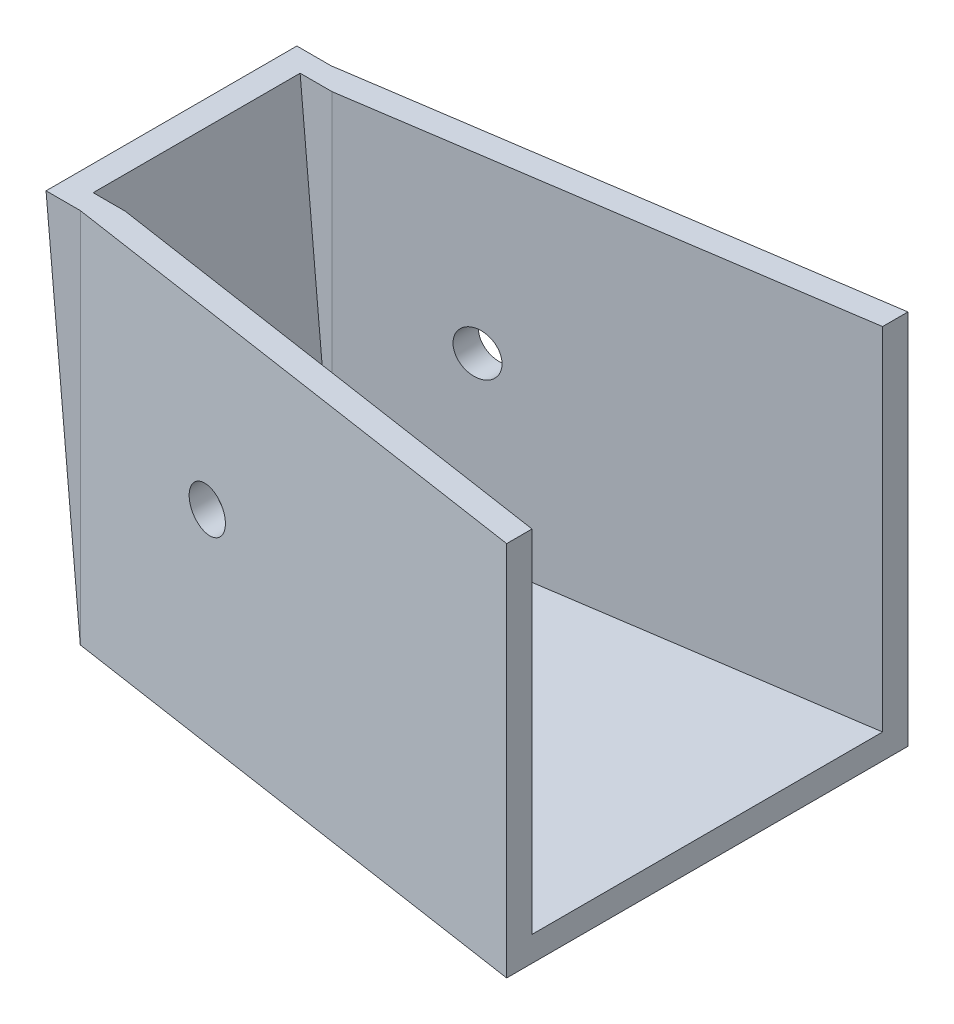
from build123d import *

# Parameters (mm, degrees)
BOSS_EXTRUDE1_DEPTH = 3
BOSS_EXTRUDE2_DEPTH = 15
BOSS_EXTRUDE3_DEPTH = 42
SKETCH6_W           = 2.622655796
SKETCH6_H           = 42
SKETCH6_H_2         = 45
BOSS_EXTRUDE4_DEPTH = 4
CUT_EXTRUDE1_DEPTH  = 88.488342941
SKETCH8_R           = 2.55
CUT_EXTRUDE2_DEPTH  = 50


with BuildPart() as part:
    # Sketch1 → Boss-Extrude1 (new body)
    with BuildSketch(Plane(origin=(0, 0, 0), x_dir=(1, 0, 0), z_dir=(0, 1, 0))):
        Polygon((-60, 0), (0, 0), (0, 24), (-60, 15), align=None)
        Polygon((-60, -15), (0, -24), (0, 0), (-60, 0), align=None)
    extrude(amount=BOSS_EXTRUDE1_DEPTH)

    # Sketch3 → Boss-Extrude2 (add, symmetric)
    with BuildSketch(Plane.XY):
        Polygon((-64.095320817, 45), (-61.082922988, 45), (-56.987602171, 0), (-60, 0), align=None)
    extrude(amount=BOSS_EXTRUDE2_DEPTH, both=True)

    # Sketch4 → Boss-Extrude3 (add)
    with BuildSketch(Plane(origin=(0, 3, 0), x_dir=(1, 0, 0), z_dir=(0, 1, 0))):
        Polygon((-57.260623559, 12.377344204), (0, 20.966437738), (0, 24), (-60, 15), (-57.260623559, 15), align=None)
        Polygon((0, -24), (0, -20.966437738), (-57.260623559, -12.377344204), (-57.260623559, -15), (-60, -15), align=None)
    extrude(amount=BOSS_EXTRUDE3_DEPTH)

    # Sketch6 → Boss-Extrude4 (add)
    with BuildSketch(Plane.ZY.offset(57.260623559)):
        with Locations((-13.688672102, 24)):
            Rectangle(SKETCH6_W, SKETCH6_H)
        with Locations((13.688672102, 22.5)):
            Rectangle(SKETCH6_W, SKETCH6_H_2)
    extrude(amount=BOSS_EXTRUDE4_DEPTH)

    # Sketch7 → Cut-Extrude1 (cut, through all)
    with BuildSketch(Plane.XY.offset(15)):
        Polygon((-61.260623559, 13.851920935), (-60, 0), (-61.260623559, 0), align=None)
    extrude(amount=-CUT_EXTRUDE1_DEPTH, mode=Mode.SUBTRACT)

    # Sketch8 → Cut-Extrude2 (cut, symmetric)
    with BuildSketch(Plane.XY.offset(15)):
        with Locations((-42.129972436, 24.312651604)):
            Circle(SKETCH8_R)
    extrude(amount=CUT_EXTRUDE2_DEPTH, both=True, mode=Mode.SUBTRACT)


solid = part.part
